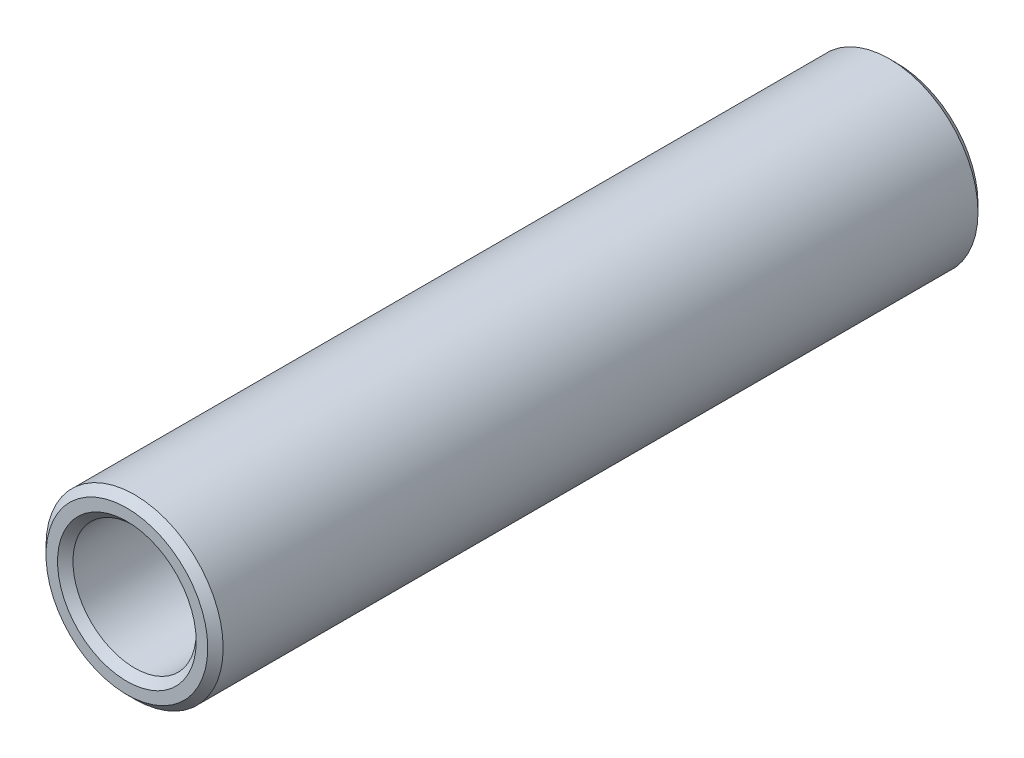
from build123d import *

# Parameters (mm, degrees)
SKETCH_1_R      = 11.5
SKETCH_1_R_2    = 8
EXTRUDE_1_DEPTH = 100
CHAMFER_1_SIZE  = 1


with BuildPart() as part:
    # 草图1 → 凸台-拉伸1 (new body)
    with BuildSketch(Plane.XY):
        Circle(SKETCH_1_R)
        Circle(SKETCH_1_R_2, mode=Mode.SUBTRACT)
    extrude(amount=EXTRUDE_1_DEPTH)

    # 倒角1
    chamfer_1_edges = [part.edges().sort_by_distance(p)[0] for p in [
        (-11.5, 0, 0),
        (-11.5, 0, 100),
        (-8, 0, 0),
        (-8, 0, 100),
    ]]
    chamfer(chamfer_1_edges, length=CHAMFER_1_SIZE)


solid = part.part
